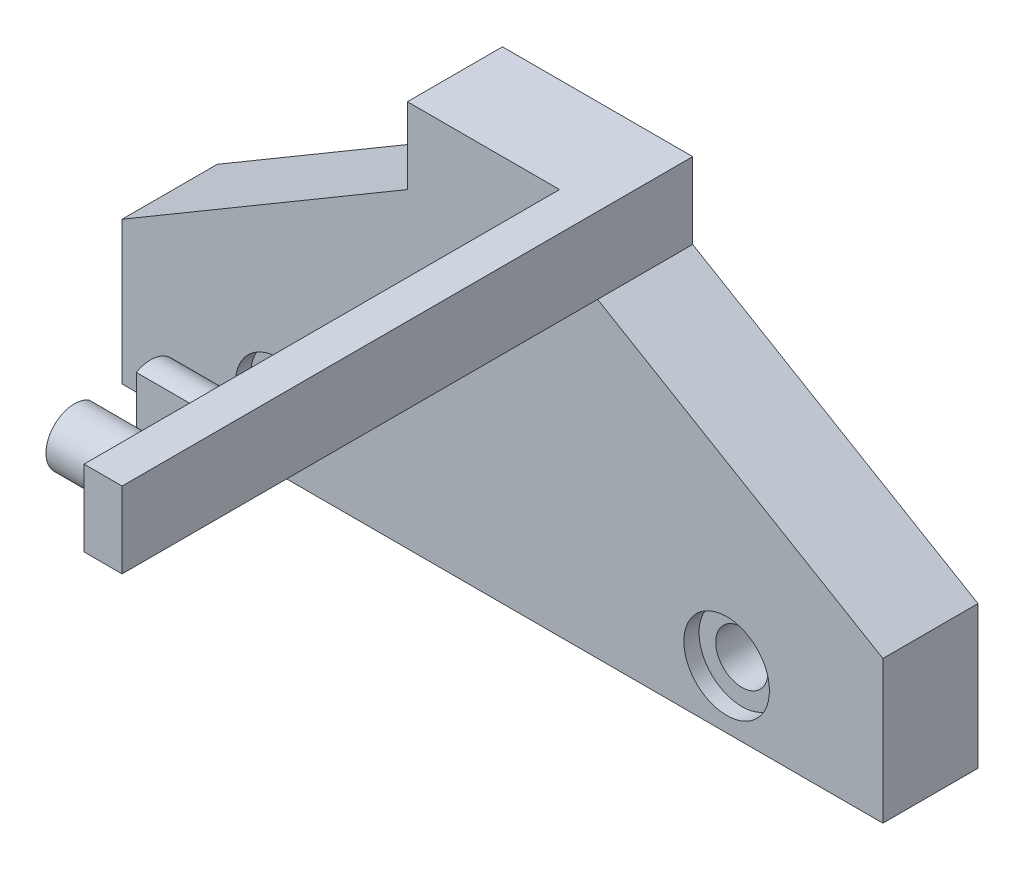
from build123d import *

# Parameters (mm, degrees)
BOSS_EXTRUDE1_DEPTH = 10
SKETCH4_R           = 2.75
CUT_EXTRUDE1_DEPTH  = 64.215786076
SKETCH6_R           = 4.5
CUT_EXTRUDE3_DEPTH  = 1.6
SKETCH7_W           = 4
SKETCH7_H           = 8
BOSS_EXTRUDE2_DEPTH = 50
SKETCH8_R           = 3
BOSS_EXTRUDE3_DEPTH = 7
SKETCH9_W           = 5
SKETCH9_H           = 8
CUT_EXTRUDE4_DEPTH  = 82.57703588


with BuildPart() as part:
    # Sketch2 → Boss-Extrude1 (new body)
    with BuildSketch(Plane.XY):
        Polygon((-24.382192178, 22.640051942), (-54.382192178, 4.940051942), (-54.382192178, -10.059948058), (25.617807822, -10.059948058), (25.617807822, 4.940051942), (-4.382192178, 22.640051942), (-4.382192178, 30.640051942), (-24.382192178, 30.640051942), align=None)
    extrude(amount=BOSS_EXTRUDE1_DEPTH)

    # Sketch4 → Cut-Extrude1 (cut, through all)
    with BuildSketch(Plane.XY.offset(10)):
        with Locations((-37.952192178, -3.959948058)):
            Circle(SKETCH4_R)
    cut_extrude1 = extrude(amount=-CUT_EXTRUDE1_DEPTH, mode=Mode.SUBTRACT)

    # Mirror2: Cut-Extrude1 across plane
    add(cut_extrude1.mirror(Plane.ZY.offset(14.382192178)), mode=Mode.SUBTRACT)

    # Sketch6 → Cut-Extrude3 (cut)
    with BuildSketch(Plane.XY.offset(10)):
        with Locations((-37.952192178, -3.959948058)):
            Circle(SKETCH6_R)
        with Locations((9.187807822, -3.959948058)):
            Circle(SKETCH6_R)
    extrude(amount=-CUT_EXTRUDE3_DEPTH, mode=Mode.SUBTRACT)

    # Sketch7 → Boss-Extrude2 (add)
    with BuildSketch(Plane.XY.offset(10)):
        with Locations((-6.382192178, 26.640051942)):
            Rectangle(SKETCH7_W, SKETCH7_H)
    extrude(amount=BOSS_EXTRUDE2_DEPTH)

    # Sketch8 → Boss-Extrude3 (add)
    with BuildSketch(Plane.ZY.offset(8.382192178)):
        with Locations(Location((54, 26.640051942, 0), (0, 0, 180))):
            Circle(SKETCH8_R)
        with Locations(Location((46, 26.640051942, 0), (0, 0, 180))):
            Circle(SKETCH8_R)
    extrude(amount=BOSS_EXTRUDE3_DEPTH)

    # Sketch9 → Cut-Extrude4 (cut, through all)
    with BuildSketch(Plane.ZY.offset(8.382192178)):
        with Locations((50, 26.640051942)):
            Rectangle(SKETCH9_W, SKETCH9_H)
    extrude(amount=CUT_EXTRUDE4_DEPTH, mode=Mode.SUBTRACT)


solid = part.part
